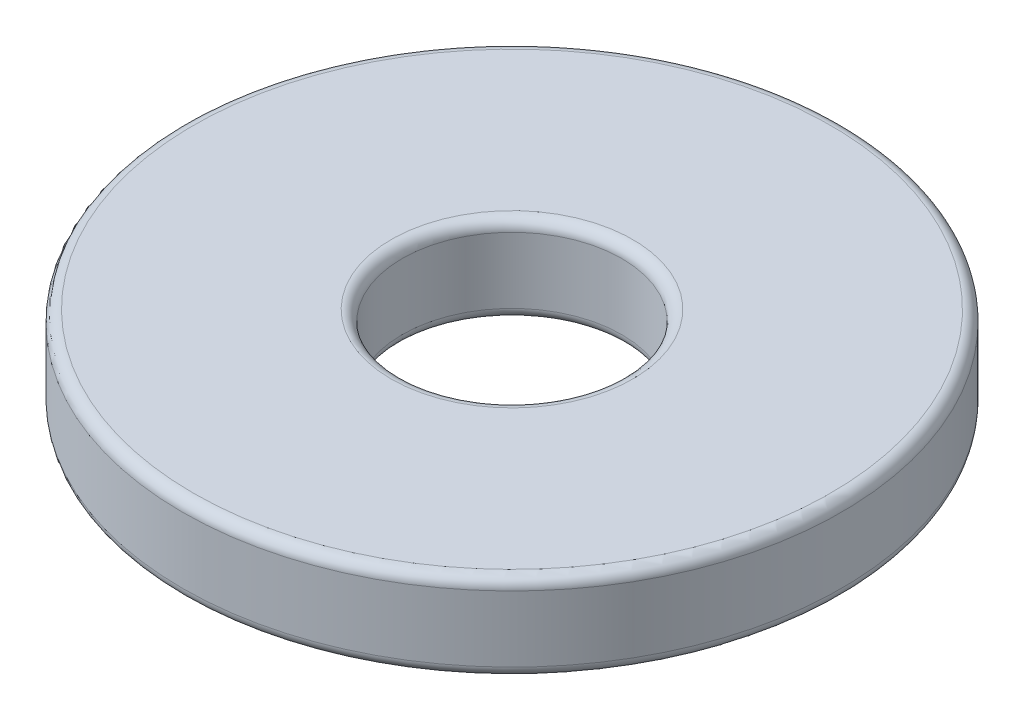
from build123d import *

# Parameters (mm, degrees)
SKETCH1_R           = 7.5
SKETCH1_R_2         = 2.5
BOSS_EXTRUDE1_DEPTH = 2
FILLET1_R           = 0.25


with BuildPart() as part:
    # Sketch1 → Boss-Extrude1 (new body)
    with BuildSketch(Plane(origin=(0, 0, 0), x_dir=(1, 0, 0), z_dir=(0, 1, 0))):
        with Locations(Location((0, 0, 0), (0, 0, 270))):
            Circle(SKETCH1_R)
        with Locations(Location((0, 0, 0), (0, 0, 270))):
            Circle(SKETCH1_R_2, mode=Mode.SUBTRACT)
    extrude(amount=BOSS_EXTRUDE1_DEPTH)

    # Fillet1
    fillet1_edges = [part.edges().sort_by_distance(p)[0] for p in [
        (0, 0, -7.5),
        (0, 2, -7.5),
        (0, 0, -2.5),
        (0, 2, -2.5),
    ]]
    fillet(fillet1_edges, radius=FILLET1_R)


solid = part.part
